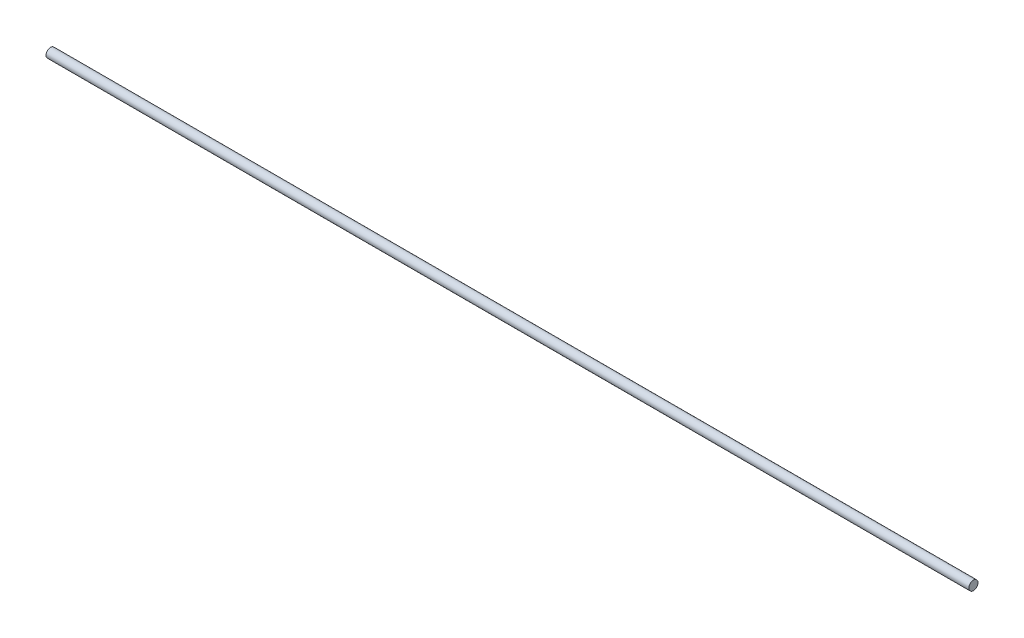
from build123d import *

# Parameters (mm, degrees)
SKETCH1_R           = 3.96875
BOSS_EXTRUDE1_DEPTH = 800


with BuildPart() as part:
    # Sketch1 → Boss-Extrude1 (new body)
    with BuildSketch(Plane(origin=(0, 0, 0), x_dir=(0, 0, -1), z_dir=(1, 0, 0))):
        with Locations(Location((0, 0, 0), (0, 0, 180))):
            Circle(SKETCH1_R)
    extrude(amount=BOSS_EXTRUDE1_DEPTH)


solid = part.part
